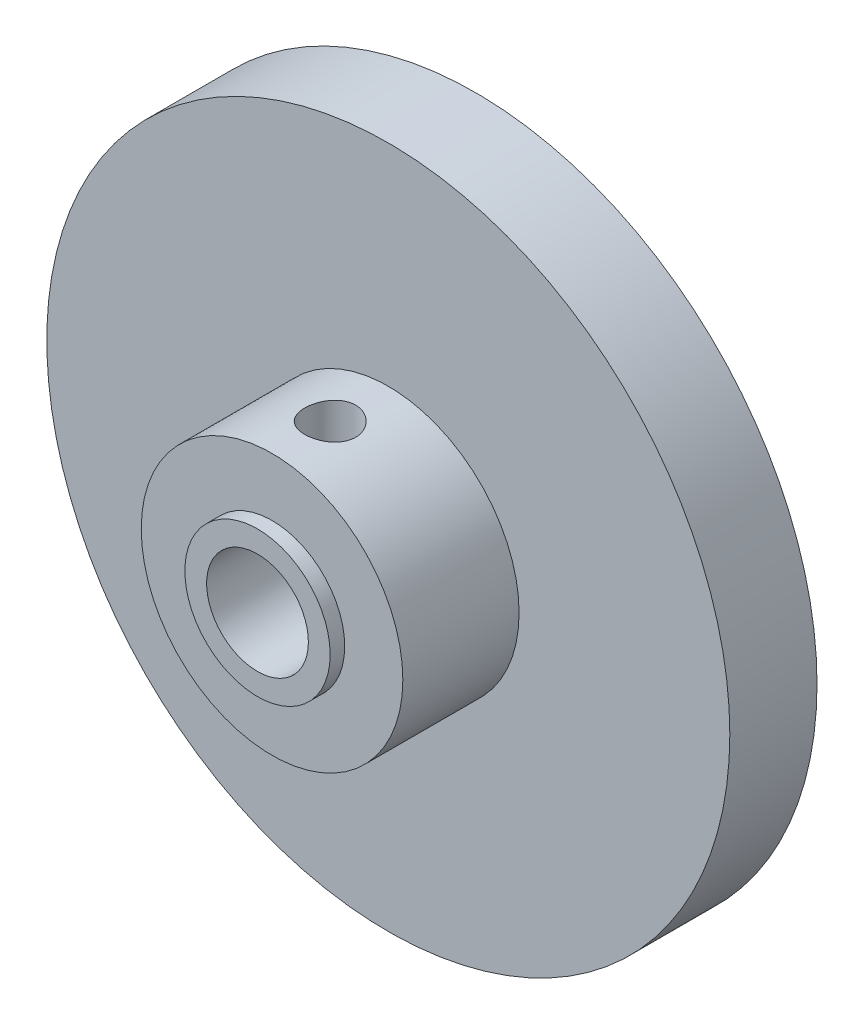
from build123d import *

# Parameters (mm, degrees)
SKETCH_1_R          = 23.5
EXTRUDE_1_DEPTH     = 6
SKETCH_2_R          = 9
EXTRUDE_2_DEPTH     = 8
SKETCH_3_R          = 3.5
CUT_EXTRUDE_1_DEPTH = 37.062445841
SKETCH_4_R          = 1.75
CUT_EXTRUDE_2_DEPTH = 37.062445841
EXTRUDE_START       = 1
SKETCH_5_R          = 5
SKETCH_5_R_2        = 3.5
EXTRUDE_3_DEPTH     = 1


with BuildPart() as part:
    # 草图1 → 凸台-拉伸1 (new body)
    with BuildSketch(Plane.XY):
        Circle(SKETCH_1_R)
    extrude(amount=EXTRUDE_1_DEPTH)

    # 草图2 → 凸台-拉伸2 (add)
    with BuildSketch(Plane.XY.offset(6)):
        Circle(SKETCH_2_R)
    extrude(amount=EXTRUDE_2_DEPTH)

    # 草图3 → 切除-拉伸1 (cut, through all)
    with BuildSketch(Plane.XY.offset(14)):
        Circle(SKETCH_3_R)
    extrude(amount=-CUT_EXTRUDE_1_DEPTH, mode=Mode.SUBTRACT)

    # 草图4 → 切除-拉伸2 (cut, through all)
    with BuildSketch(Plane(origin=(0, 0, 0), x_dir=(1, 0, 0), z_dir=(0, 1, 0))):
        with Locations(Location((0, -10, 0), (0, 0, 90))):
            Circle(SKETCH_4_R)
    extrude(amount=CUT_EXTRUDE_2_DEPTH, mode=Mode.SUBTRACT)

    # 草图5 → 凸台-拉伸3 (add)
    with BuildSketch(Plane.XY.offset(14).offset(EXTRUDE_START)):
        Circle(SKETCH_5_R)
        Circle(SKETCH_5_R_2, mode=Mode.SUBTRACT)
    extrude(amount=-EXTRUDE_3_DEPTH)


solid = part.part
